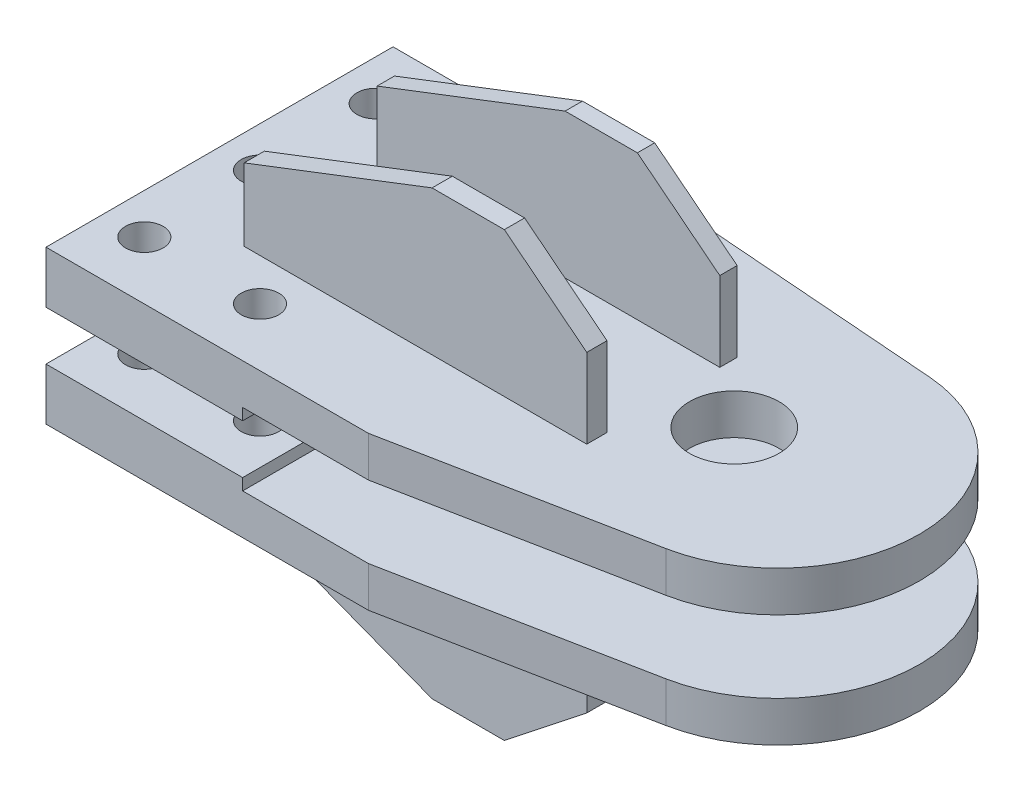
from build123d import *
from build123d.topology import SkipClean

# Parameters (mm, degrees)
SKETCH_1_R          = 31
SKETCH_1_R_2        = 13
EXTRUDE_1_DEPTH     = 28
SKETCH_2_W          = 237
SKETCH_2_H          = 12
SKETCH_2_H_2        = 14
EXTRUDE_2_DEPTH     = 100
CUT_EXTRUDE_1_DEPTH = 521.566038078
EXTRUDE_START       = 8
SKETCH_4_W          = 136
SKETCH_4_H          = 240
SKETCH_4_R          = 13
EXTRUDE_3_DEPTH     = 8


with BuildPart() as part:
    # 草图1 → 凸台-拉伸1 (new body)
    with BuildSketch(Plane(origin=(0, 0, 0), x_dir=(1, 0, 0), z_dir=(0, 1, 0))):
        with BuildLine():
            Line((0, 120), (0, -120))
            Line((0, -120), (223, -120))
            Line((223, -120), (394.928728095, -86.154579988))
            ThreePointArc((394.928728095, -86.154579988), (473.829584875, 15.776878329), (383.480702502, 107.714068025))
            Line((383.480702502, 107.714068025), (223, 120))
            Line((223, 120), (0, 120))
        make_face()
        with Locations(Location((346, 10, 0), (0, 0, 270))):
            Circle(SKETCH_1_R, mode=Mode.SUBTRACT)
        with Locations(Location((28, 80, 0), (0, 0, 270))):
            Circle(SKETCH_1_R_2, mode=Mode.SUBTRACT)
        with Locations(Location((28, 0, 0), (0, 0, 270))):
            Circle(SKETCH_1_R_2, mode=Mode.SUBTRACT)
        with Locations(Location((28, -80, 0), (0, 0, 270))):
            Circle(SKETCH_1_R_2, mode=Mode.SUBTRACT)
        with Locations(Location((108, 80, 0), (0, 0, 270))):
            Circle(SKETCH_1_R_2, mode=Mode.SUBTRACT)
        with Locations(Location((108, 0, 0), (0, 0, 270))):
            Circle(SKETCH_1_R_2, mode=Mode.SUBTRACT)
        with Locations(Location((108, -80, 0), (0, 0, 270))):
            Circle(SKETCH_1_R_2, mode=Mode.SUBTRACT)
    extrude(amount=EXTRUDE_1_DEPTH)

    # 草图2 → 凸台-拉伸2 (add)
    with BuildSketch(Plane(origin=(0, 28, 0), x_dir=(1, 0, 0), z_dir=(0, 1, 0))):
        with Locations((186.5, 47)):
            Rectangle(SKETCH_2_W, SKETCH_2_H)
        with Locations((186.5, -44)):
            Rectangle(SKETCH_2_W, SKETCH_2_H_2)
    extrude(amount=EXTRUDE_2_DEPTH)

    # 草图3 → 切除-拉伸1 (cut, through all)
    with BuildSketch(Plane(origin=(0, 0, -53), x_dir=(1, 0, 0), z_dir=(0, 0, -1))):
        Polygon((305, -128), (305, -83), (248, -128), align=None)
        Polygon((68, -128), (68, -78), (198, -128), align=None)
    extrude(amount=-CUT_EXTRUDE_1_DEPTH, mode=Mode.SUBTRACT)

    # 草图4 → 凸台-拉伸3 (add)
    with SkipClean():  # the faces are left unmerged after this step: merging them gives an invalid solid
        with BuildSketch(Plane(origin=(0, 0, 0), x_dir=(-1, 0, 0), z_dir=(0, -1, 0)).offset(EXTRUDE_START)):
            with Locations((-68, 0)):
                Rectangle(SKETCH_4_W, SKETCH_4_H)
            with Locations(Location((-28, -80, 0), (0, 0, 90))):
                Circle(SKETCH_4_R, mode=Mode.SUBTRACT)
            with Locations(Location((-108, -80, 0), (0, 0, 90))):
                Circle(SKETCH_4_R, mode=Mode.SUBTRACT)
            with Locations(Location((-28, 0, 0), (0, 0, 90))):
                Circle(SKETCH_4_R, mode=Mode.SUBTRACT)
            with Locations(Location((-108, 0, 0), (0, 0, 90))):
                Circle(SKETCH_4_R, mode=Mode.SUBTRACT)
            with Locations(Location((-28, 80, 0), (0, 0, 90))):
                Circle(SKETCH_4_R, mode=Mode.SUBTRACT)
            with Locations(Location((-108, 80, 0), (0, 0, 90))):
                Circle(SKETCH_4_R, mode=Mode.SUBTRACT)
        extrude(amount=-EXTRUDE_3_DEPTH)


with BuildPart() as body_2:
    # 镜向1: mirrored copy
    add(part.part.mirror(Plane.ZX.offset(-25)))


solid = Compound([part.part, body_2.part])
